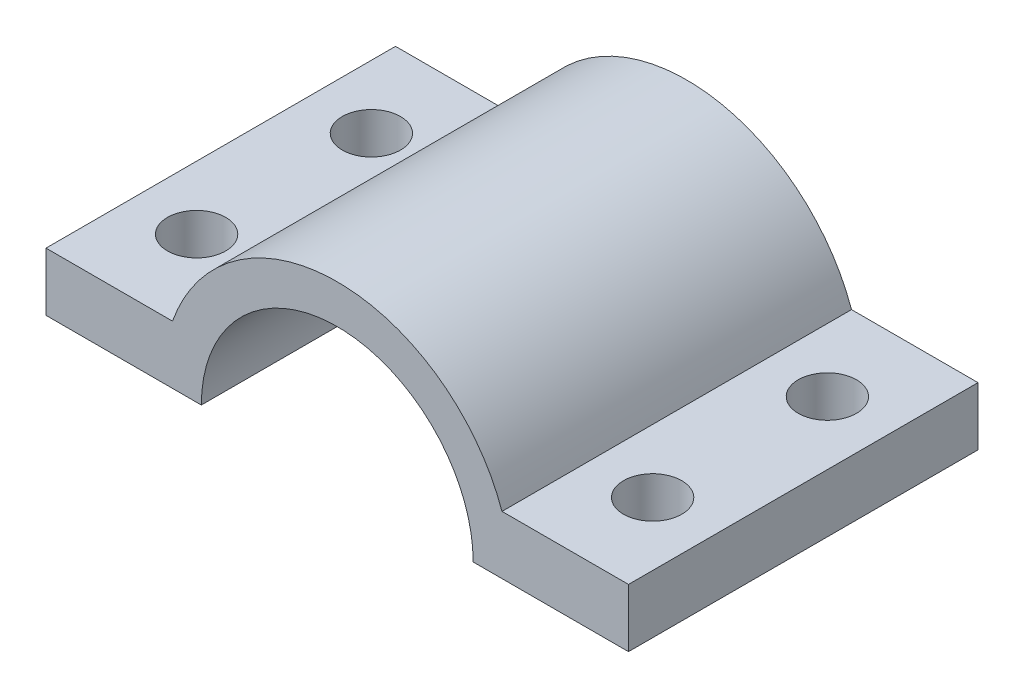
from build123d import *

# Parameters (mm, degrees)
EXTRUDE_1_DEPTH      = 18
EXTRUDE_2_REACH      = 37.341
EXTRUDE_2_END_RADIUS = 7
SKETCH_3_R           = 3.5
CUT_EXTRUDE_1_DEPTH  = 3


with BuildPart() as part:
    # 草图1 → 凸台-拉伸1 (new body)
    with BuildSketch(Plane.XY):
        with BuildLine():
            Line((0, 0), (8, 0))
            ThreePointArc((8, 0), (15, 7), (22, 0))
            Line((22, 0), (30, 0))
            Line((30, 0), (30, 3))
            Line((30, 3), (23.485281374, 3))
            ThreePointArc((23.485281374, 3), (15, 9), (6.514718626, 3))
            Line((6.514718626, 3), (0, 3))
            Line((0, 3), (0, 0))
        make_face()
    extrude(amount=EXTRUDE_1_DEPTH)

    # 凸台-拉伸2: up to this cylinder (the profile starts inside it)
    extrude_2_end = Plane(origin=(15, 0, 7.5), z_dir=(0, 0, -1)) * Cylinder(EXTRUDE_2_END_RADIUS, 89.682, mode=Mode.PRIVATE)
    # 草图3 → 凸台-拉伸2 (add, up to the surface)
    with BuildSketch(Plane(origin=(0, 4, 0), x_dir=(1, 0, 0), z_dir=(0, 1, 0)), mode=Mode.PRIVATE) as extrude_2_sk1:
        with Locations(Location((15, -7.5, 0), (0, 0, 90))):
            Circle(SKETCH_3_R)
    extrude_2_tool1 = extrude(extrude_2_sk1.sketch, amount=EXTRUDE_2_REACH, mode=Mode.PRIVATE) & extrude_2_end
    add(extrude_2_tool1.solids().sort_by_distance((15, 4, 7.5))[0])

    # 草图4 → 切除-拉伸1 (cut)
    with BuildSketch(Plane(origin=(0, 3, 0), x_dir=(1, 0, 0), z_dir=(0, 1, 0))):
        with BuildLine():
            ThreePointArc((4.757359313, -4.5), (4.318019485, -3.439339828), (3.257359313, -3))
            Line((3.257359313, -3), (3.257359313, -6))
            ThreePointArc((3.257359313, -6), (4.318019485, -5.560660172), (4.757359313, -4.5))
        make_face()
        with BuildLine():
            Line((3.257359313, -6), (3.257359313, -3))
            ThreePointArc((3.257359313, -3), (1.757359313, -4.5), (3.257359313, -6))
        make_face()
        with BuildLine():
            ThreePointArc((4.757359313, -13.5), (4.318019485, -12.439339828), (3.257359313, -12))
            Line((3.257359313, -12), (3.257359313, -15))
            ThreePointArc((3.257359313, -15), (4.318019485, -14.560660172), (4.757359313, -13.5))
        make_face()
        with BuildLine():
            Line((3.257359313, -15), (3.257359313, -12))
            ThreePointArc((3.257359313, -12), (1.757359313, -13.5), (3.257359313, -15))
        make_face()
        with BuildLine():
            ThreePointArc((28.242640687, -4.5), (27.803300859, -3.439339828), (26.742640687, -3))
            Line((26.742640687, -3), (26.742640687, -6))
            ThreePointArc((26.742640687, -6), (27.803300859, -5.560660172), (28.242640687, -4.5))
        make_face()
        with BuildLine():
            Line((26.742640687, -6), (26.742640687, -3))
            ThreePointArc((26.742640687, -3), (25.242640687, -4.5), (26.742640687, -6))
        make_face()
        with BuildLine():
            ThreePointArc((28.242640687, -13.5), (27.803300859, -12.439339828), (26.742640687, -12))
            Line((26.742640687, -12), (26.742640687, -15))
            ThreePointArc((26.742640687, -15), (27.803300859, -14.560660172), (28.242640687, -13.5))
        make_face()
        with BuildLine():
            Line((26.742640687, -15), (26.742640687, -12))
            ThreePointArc((26.742640687, -12), (25.242640687, -13.5), (26.742640687, -15))
        make_face()
    extrude(amount=-CUT_EXTRUDE_1_DEPTH, mode=Mode.SUBTRACT)


solid = part.part
